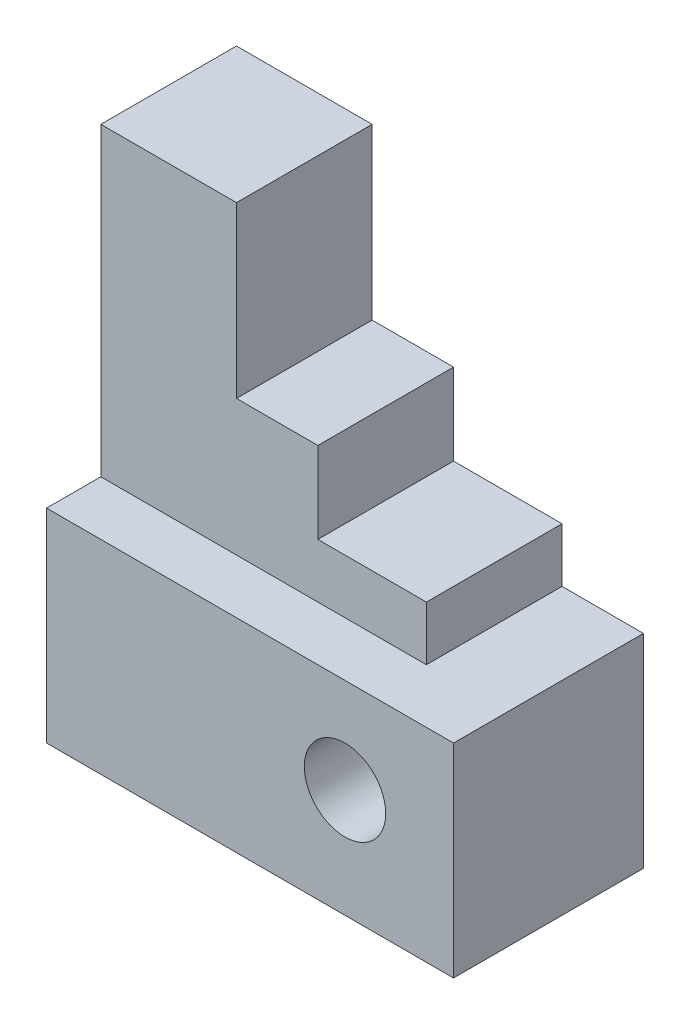
from build123d import *

# Parameters (mm, degrees)
SKETCH1_W           = 60
SKETCH1_H           = 28
BOSS_EXTRUDE1_DEPTH = 30
SKETCH2_W           = 48
SKETCH2_H           = 20
BOSS_EXTRUDE2_DEPTH = 8
SKETCH2_3_W         = 32
SKETCH2_3_H         = 20
BOSS_EXTRUDE3_DEPTH = 20
SKETCH2_4_W         = 20
SKETCH2_4_H         = 20
BOSS_EXTRUDE4_DEPTH = 45
SKETCH4_R           = 6
CUT_EXTRUDE1_DEPTH  = 86.492689746


with BuildPart() as part:
    # Sketch1 → Boss-Extrude1 (new body)
    with BuildSketch(Plane(origin=(0, 0, 0), x_dir=(1, 0, 0), z_dir=(0, 1, 0))):
        Rectangle(SKETCH1_W, SKETCH1_H)
    extrude(amount=BOSS_EXTRUDE1_DEPTH)

    # Sketch2 → Boss-Extrude2 (add)
    with BuildSketch(Plane(origin=(0, 30, 0), x_dir=(1, 0, 0), z_dir=(0, 1, 0))):
        with Locations((-6, 4)):
            Rectangle(SKETCH2_W, SKETCH2_H)
    extrude(amount=BOSS_EXTRUDE2_DEPTH)

    # Sketch2<3> → Boss-Extrude3 (add)
    with BuildSketch(Plane(origin=(0, 30, 0), x_dir=(1, 0, 0), z_dir=(0, 1, 0))):
        with Locations((-14, 4)):
            Rectangle(SKETCH2_3_W, SKETCH2_3_H)
    extrude(amount=BOSS_EXTRUDE3_DEPTH)

    # Sketch2<4> → Boss-Extrude4 (add)
    with BuildSketch(Plane(origin=(0, 30, 0), x_dir=(1, 0, 0), z_dir=(0, 1, 0))):
        with Locations((-20, 4)):
            Rectangle(SKETCH2_4_W, SKETCH2_4_H)
    extrude(amount=BOSS_EXTRUDE4_DEPTH)

    # Sketch4 → Cut-Extrude1 (cut, through all)
    with BuildSketch(Plane.XY.offset(14)):
        with Locations((14, 16)):
            Circle(SKETCH4_R)
    extrude(amount=-CUT_EXTRUDE1_DEPTH, mode=Mode.SUBTRACT)


solid = part.part
